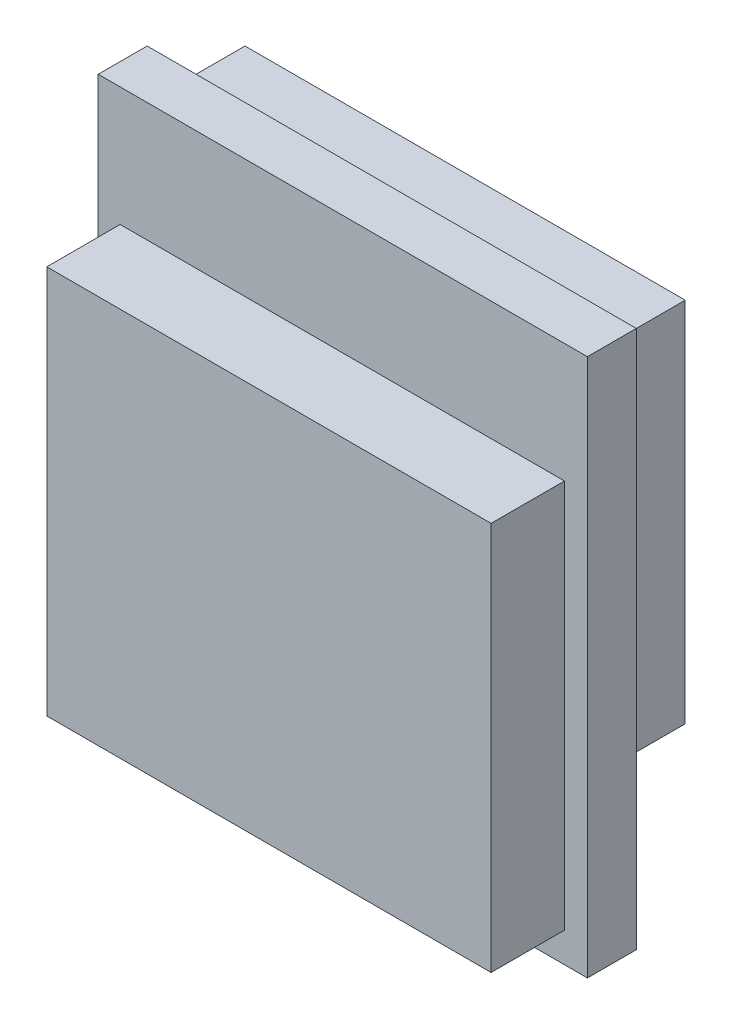
from build123d import *

# Parameters (mm, degrees)
SKETCH1_W           = 18
SKETCH1_H           = 15
BOSS_EXTRUDE1_DEPTH = 3
SKETCH2_W           = 20
SKETCH2_H           = 22
BOSS_EXTRUDE2_DEPTH = 2
SKETCH3_W           = 18.166927201
SKETCH3_H           = 15.903506762
BOSS_EXTRUDE3_DEPTH = 3


with BuildPart() as part:
    # Sketch1 → Boss-Extrude1 (new body)
    with BuildSketch(Plane.XY):
        with Locations((-68.585871194, -139.978474406)):
            Rectangle(SKETCH1_W, SKETCH1_H)
    extrude(amount=BOSS_EXTRUDE1_DEPTH)

    # Sketch2 → Boss-Extrude2 (add)
    with BuildSketch(Plane.XY.offset(3)):
        with Locations((-68.585871194, -142.478474406)):
            Rectangle(SKETCH2_W, SKETCH2_H)
    extrude(amount=BOSS_EXTRUDE2_DEPTH)

    # Sketch3 → Boss-Extrude3 (add)
    with BuildSketch(Plane.XY.offset(5)):
        with Locations((-68.607051799, -144.301260384)):
            Rectangle(SKETCH3_W, SKETCH3_H)
    extrude(amount=BOSS_EXTRUDE3_DEPTH)


solid = part.part
